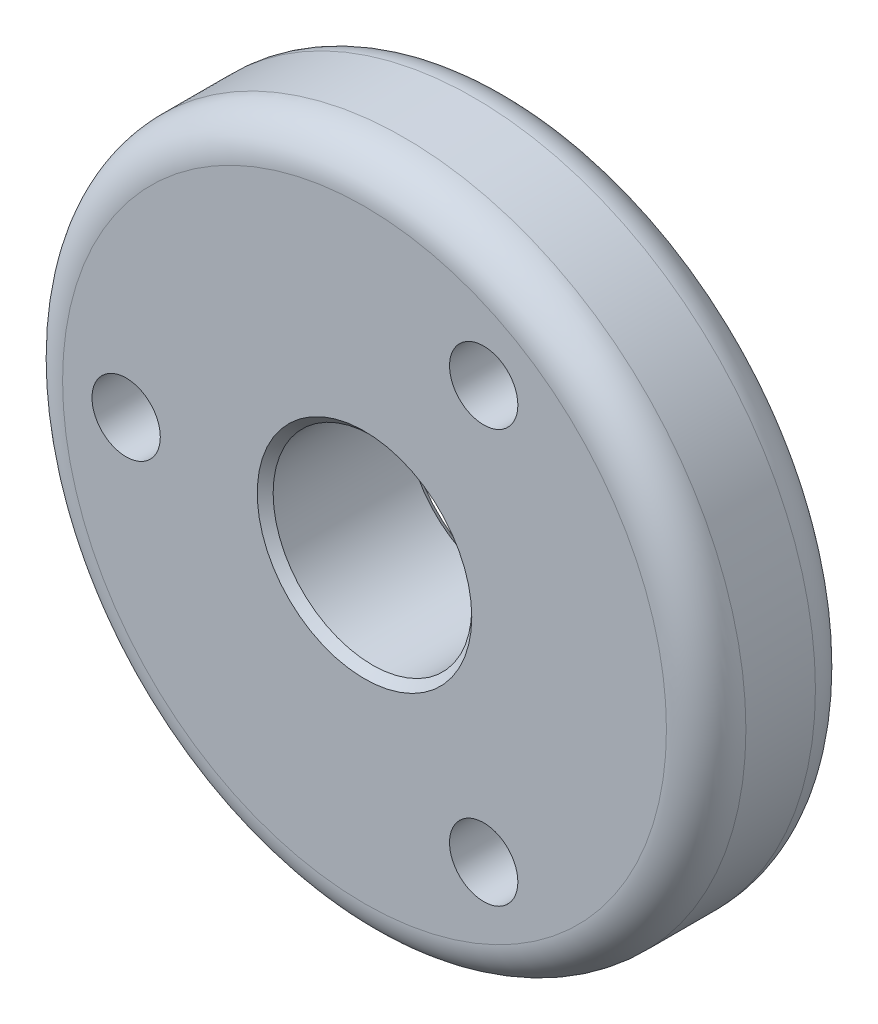
from build123d import *

# Parameters (mm, degrees)
SKETCH1_R           = 5.461
SKETCH1_R_2         = 1.5875
BOSS_EXTRUDE1_DEPTH = 1.190625
FILLET1_R           = 0.635
CHAMFER1_SIZE       = 0.127
SKETCH2_R           = 0.5461
CUT_EXTRUDE1_DEPTH  = 9.081794025
CIRPATTERN1_COUNT   = 3


with BuildPart() as part:
    # Sketch1 → Boss-Extrude1 (new, symmetric)
    with BuildSketch(Plane.XY):
        with Locations(Location((0, 0, 0), (0, 0, 180))):
            Circle(SKETCH1_R)
        with Locations(Location((0, 0, 0), (0, 0, 180))):
            Circle(SKETCH1_R_2, mode=Mode.SUBTRACT)
    extrude(amount=BOSS_EXTRUDE1_DEPTH, both=True)

    # Fillet1
    fillet1_edges = [part.edges().sort_by_distance(p)[0] for p in [
        (5.461, 0, -1.190625),
        (5.461, 0, 1.190625),
    ]]
    fillet(fillet1_edges, radius=FILLET1_R)

    # Chamfer1
    chamfer1_edges = [part.edges().sort_by_distance(p)[0] for p in [
        (1.5875, 0, -1.190625),
        (1.5875, 0, 1.190625),
    ]]
    chamfer(chamfer1_edges, length=CHAMFER1_SIZE)

    # Sketch2 → Cut-Extrude1 (cut, through all)
    with BuildSketch(Plane.XY.offset(1.190625)):
        with Locations((-3.81, 0)):
            Circle(SKETCH2_R)
    cut_extrude1 = extrude(amount=-CUT_EXTRUDE1_DEPTH, mode=Mode.SUBTRACT)

    # CirPattern1: Cut-Extrude1 ×3 about axis
    cirpattern1_axis = Axis((0, 0, 0), (0, 0, 1))
    for i in range(1, CIRPATTERN1_COUNT):
        add(cut_extrude1.rotate(cirpattern1_axis, i * 360 / CIRPATTERN1_COUNT), mode=Mode.SUBTRACT)


solid = part.part
